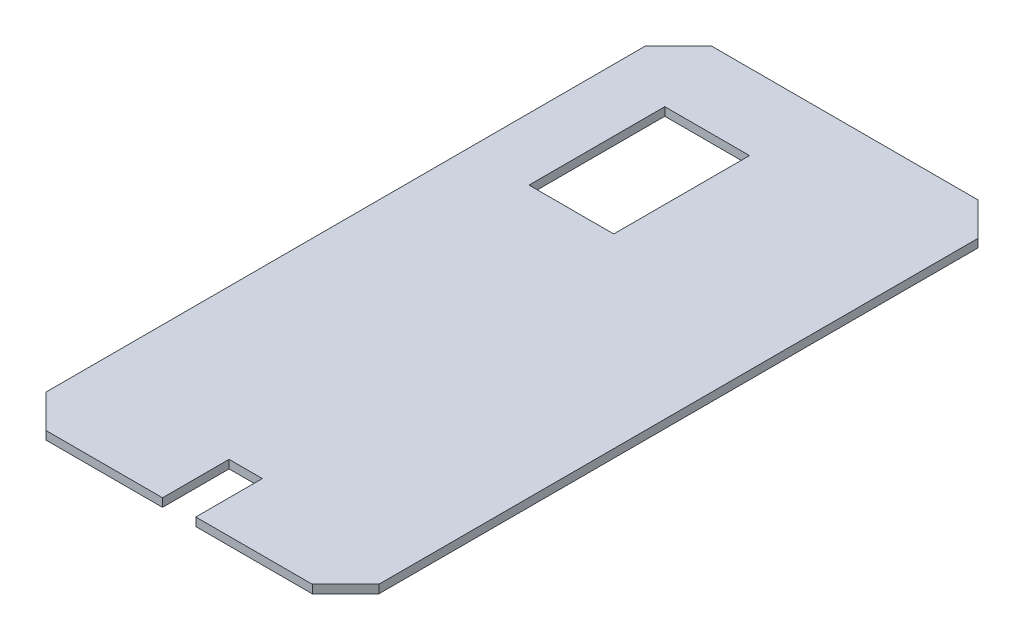
from build123d import *

# Parameters (mm, degrees)
SKETCH2_W           = 32.310298855
SKETCH2_H           = 51.805263964
BOSS_EXTRUDE1_DEPTH = 3.175


with BuildPart() as part:
    # Sketch2 → Boss-Extrude1 (new body)
    with BuildSketch(Plane(origin=(0, 0, 0), x_dir=(1, 0, 0), z_dir=(0, 1, 0))):
        Polygon((0, 241.3), (0, 12.7), (12.7, 0), (57.15, 0), (57.15, 25.4), (69.85, 25.4), (69.85, 0), (114.3, 0), (127, 12.7), (127, 241.3), (114.3, 254), (12.7, 254), align=None)
        with Locations((39.907037714, 199.150091426)):
            Rectangle(SKETCH2_W, SKETCH2_H, mode=Mode.SUBTRACT)
    extrude(amount=BOSS_EXTRUDE1_DEPTH)


solid = part.part
